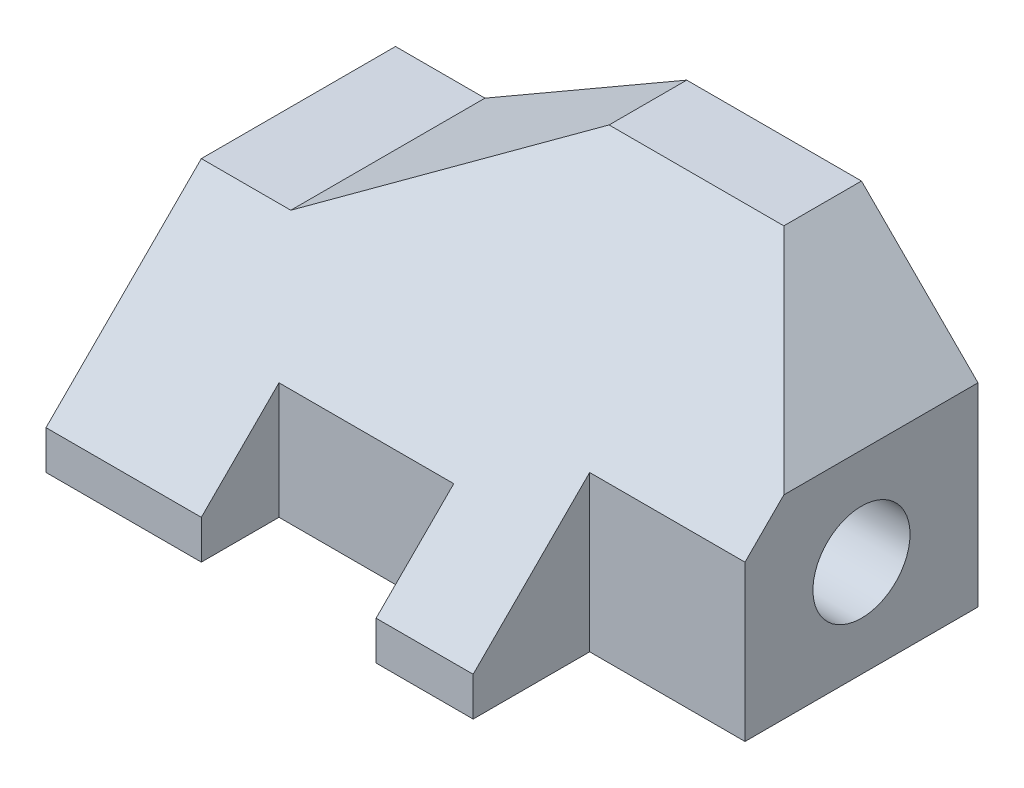
from build123d import *

# Parameters (mm, degrees)
ESQUISSE1_W                 = 95.25
ESQUISSE1_H                 = 57.15
CREATION_FORME_D_PART_DEPTH = 50.8
ENLEVE_COINS_DEPTH          = 127
F_45_DEGREE_DEPTH           = 127
ESQUISSE5_W                 = 25.4
ESQUISSE5_H                 = 19.05
ESQUISSE5_W_2               = 28.575
ESQUISSE5_H_2               = 12.7
CUBES_DE_COTE_DEPTH         = 127
PERCAGE_D                   = 15.875
PERCAGE_DEPTH               = 31.75
PERCAGE_TIP                 = 4.769331164


with BuildPart() as part:
    # Esquisse1 → Creation forme départ (new body)
    with BuildSketch(Plane(origin=(0, 0, 0), x_dir=(1, 0, 0), z_dir=(0, 1, 0))):
        Rectangle(ESQUISSE1_W, ESQUISSE1_H)
    extrude(amount=CREATION_FORME_D_PART_DEPTH)

    # Esquisse3 → Enleve coins (cut)
    with BuildSketch(Plane.XY.offset(28.575)):
        Polygon((47.625, 50.8), (28.575, 50.8), (47.625, 31.75), align=None)
        Polygon((0, 50.8), (-32.995567884, 31.75), (-47.625, 31.75), (-47.625, 50.8), align=None)
    extrude(amount=-ENLEVE_COINS_DEPTH, mode=Mode.SUBTRACT)

    # Esquisse4 → 45 degree (cut)
    with BuildSketch(Plane(origin=(47.625, 0, 0), x_dir=(0, 0, -1), z_dir=(1, 0, 0))):
        Polygon((15.875, 50.8), (-28.575, 50.8), (-28.575, 6.35), align=None)
    extrude(amount=-F_45_DEGREE_DEPTH, mode=Mode.SUBTRACT)

    # Esquisse5 → Cubes de cote (cut)
    with BuildSketch(Plane.XZ):
        with Locations((34.925, 19.05)):
            Rectangle(ESQUISSE5_W, ESQUISSE5_H)
        with Locations((-7.9375, 22.225)):
            Rectangle(ESQUISSE5_W_2, ESQUISSE5_H_2)
    extrude(amount=-CUBES_DE_COTE_DEPTH, mode=Mode.SUBTRACT)

    # Percage
    with Locations(Plane(origin=(47.625, 0, 0), x_dir=(0, 0, -1), z_dir=(1, 0, 0))):
        with Locations((9.525, 15.875)):
            Hole(PERCAGE_D / 2, depth=PERCAGE_DEPTH)
            with Locations((0, 0, -(PERCAGE_DEPTH + PERCAGE_TIP / 2))):  # 118° drill point
                Cone(0, PERCAGE_D / 2, PERCAGE_TIP, mode=Mode.SUBTRACT)


solid = part.part
